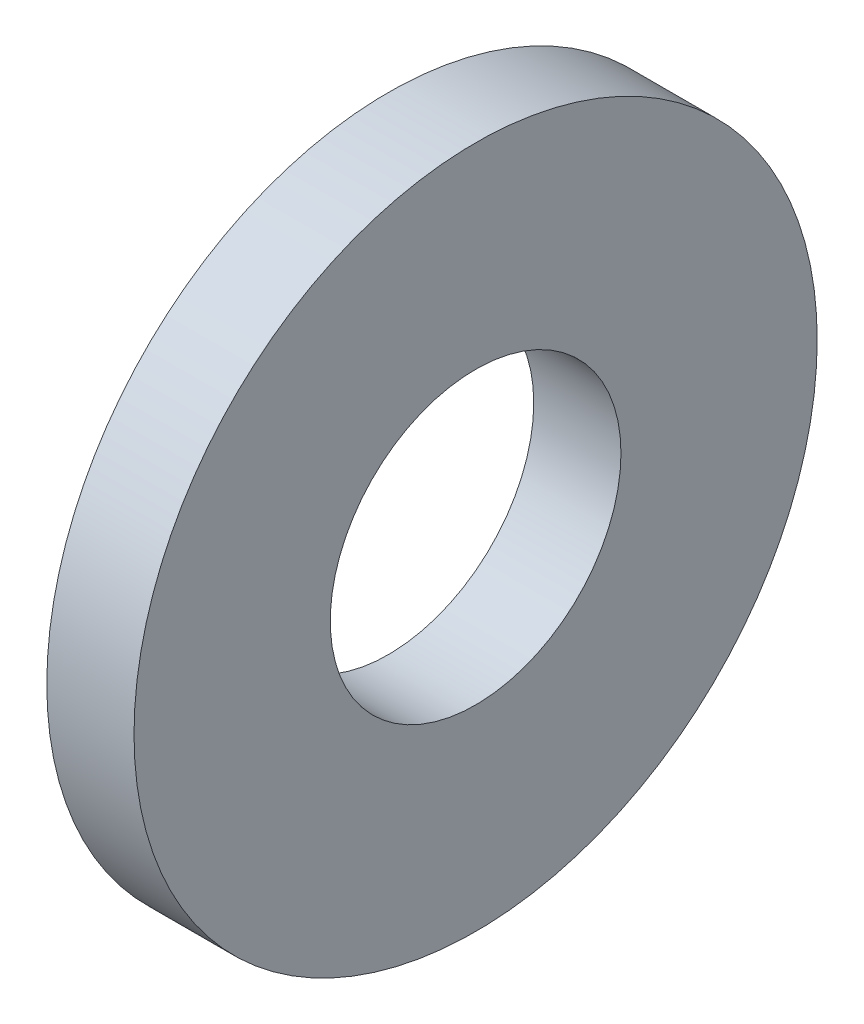
from build123d import *

# Parameters (mm, degrees)
SKETCH1_R           = 11.75
SKETCH1_R_2         = 5
BOSS_EXTRUDE1_DEPTH = 3


with BuildPart() as part:
    # Sketch1 → Boss-Extrude1 (new body)
    with BuildSketch(Plane(origin=(0, 0, 0), x_dir=(0, 0, -1), z_dir=(1, 0, 0))):
        Circle(SKETCH1_R)
        Circle(SKETCH1_R_2, mode=Mode.SUBTRACT)
    extrude(amount=BOSS_EXTRUDE1_DEPTH)


solid = part.part
